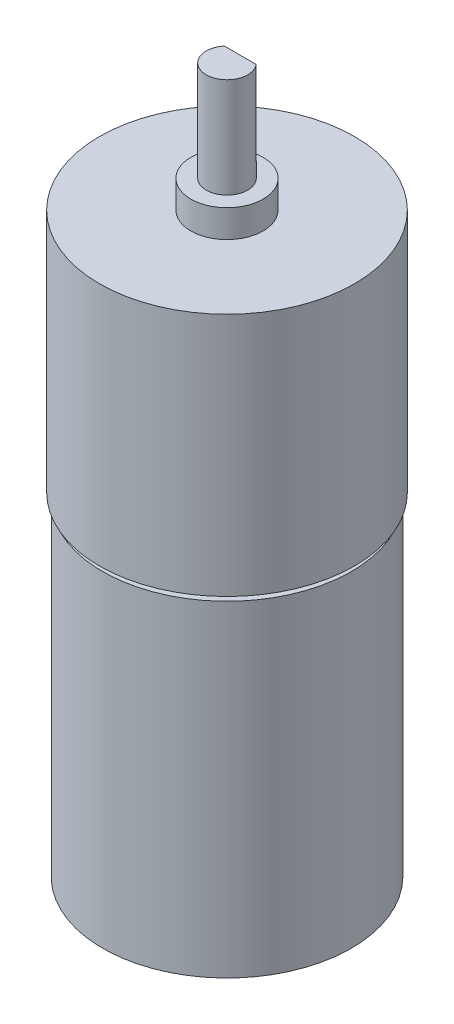
from build123d import *

# Parameters (mm, degrees)
SKETCH_1_R          = 12
EXTRUDE_1_DEPTH     = 54.3
SKETCH_2_R          = 3.4
SKETCH_2_R_2        = 1.95
EXTRUDE_2_DEPTH     = 2.6
SKETCH_3_R          = 1.95
EXTRUDE_3_DEPTH     = 12
CUT_EXTRUDE_START   = -8
CUT_EXTRUDE_1_DEPTH = 8


with BuildPart() as part:
    # 草图1 → 凸台-拉伸1 (new body)
    with BuildSketch(Plane(origin=(0, 0, 0), x_dir=(1, 0, 0), z_dir=(0, 1, 0))):
        with Locations(Location((0, 0, 0), (0, 0, 90))):
            Circle(SKETCH_1_R)
    extrude(amount=EXTRUDE_1_DEPTH)

    # 草图2 → 凸台-拉伸2 (add)
    with BuildSketch(Plane(origin=(0, 54.3, 0), x_dir=(1, 0, 0), z_dir=(0, 1, 0))):
        with Locations(Location((0, 0, 0), (0, 0, 270))):
            Circle(SKETCH_2_R)
        with Locations(Location((0, 0, 0), (0, 0, 270))):
            Circle(SKETCH_2_R_2, mode=Mode.SUBTRACT)
    extrude(amount=EXTRUDE_2_DEPTH)

    # 草图3 → 凸台-拉伸3 (add)
    with BuildSketch(Plane(origin=(0, 54.3, 0), x_dir=(1, 0, 0), z_dir=(0, 1, 0))):
        with Locations(Location((0, 0, 0), (0, 0, 270))):
            Circle(SKETCH_3_R)
    extrude(amount=EXTRUDE_3_DEPTH)

    # 草图4 → 切除-拉伸1 (cut)
    with BuildSketch(Plane(origin=(0, 66.3, 0), x_dir=(1, 0, 0), z_dir=(0, 1, 0)).offset(CUT_EXTRUDE_START)):
        with BuildLine():
            Line((-1.5, 1.245993579), (1.5, 1.245993579))
            ThreePointArc((1.5, 1.245993579), (0, 1.95), (-1.5, 1.245993579))
        make_face()
    extrude(amount=CUT_EXTRUDE_1_DEPTH, mode=Mode.SUBTRACT)

    # 草图5 → 切除-旋转1 (revolve, cut)
    with BuildSketch(Plane(origin=(0, 0, 0), x_dir=(0, 0, -1), z_dir=(1, 0, 0))):
        Polygon((12, 31.3), (11, 31.3), (11, 30.7), (11.7, 30.7), (11.7, 0), (12, 0), (12, 30.7), align=None)
    revolve(axis=Axis((0, -3.315, 0), (0, 1, 0)), mode=Mode.SUBTRACT)


solid = part.part
